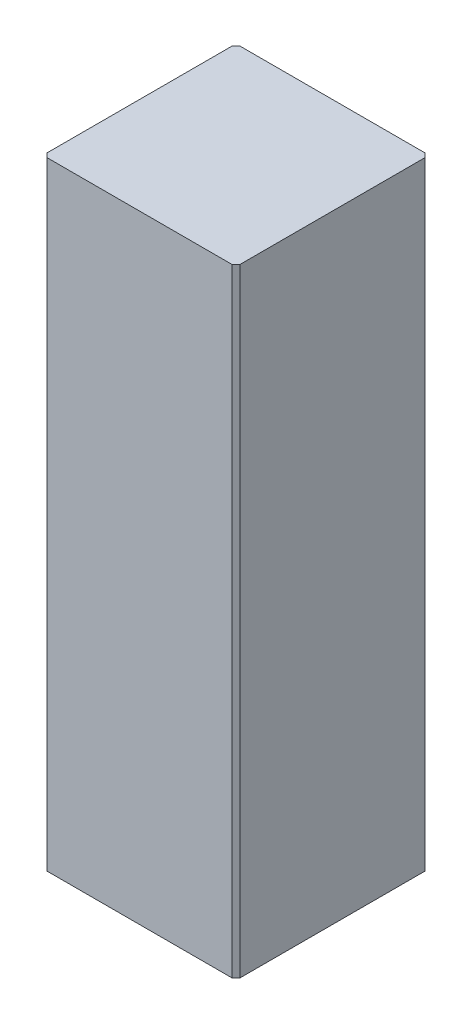
from build123d import *

# Parameters (mm, degrees)
SKETCH1_W           = 6.35
SKETCH1_H           = 6.35
BOSS_EXTRUDE1_DEPTH = 20.32
CHAMFER1_SIZE       = 0.127


with BuildPart() as part:
    # Sketch1 → Boss-Extrude1 (new body)
    with BuildSketch(Plane(origin=(0, 0, 0), x_dir=(1, 0, 0), z_dir=(0, 1, 0))):
        with Locations((3.175, 3.175)):
            Rectangle(SKETCH1_W, SKETCH1_H)
    extrude(amount=BOSS_EXTRUDE1_DEPTH)

    # Chamfer1
    chamfer1_edges = [part.edges().sort_by_distance(p)[0] for p in [
        (0, 10.16, -6.35),
        (6.35, 10.16, -6.35),
        (6.35, 10.16, 0),
        (0, 10.16, 0),
    ]]
    chamfer(chamfer1_edges, length=CHAMFER1_SIZE)


solid = part.part
